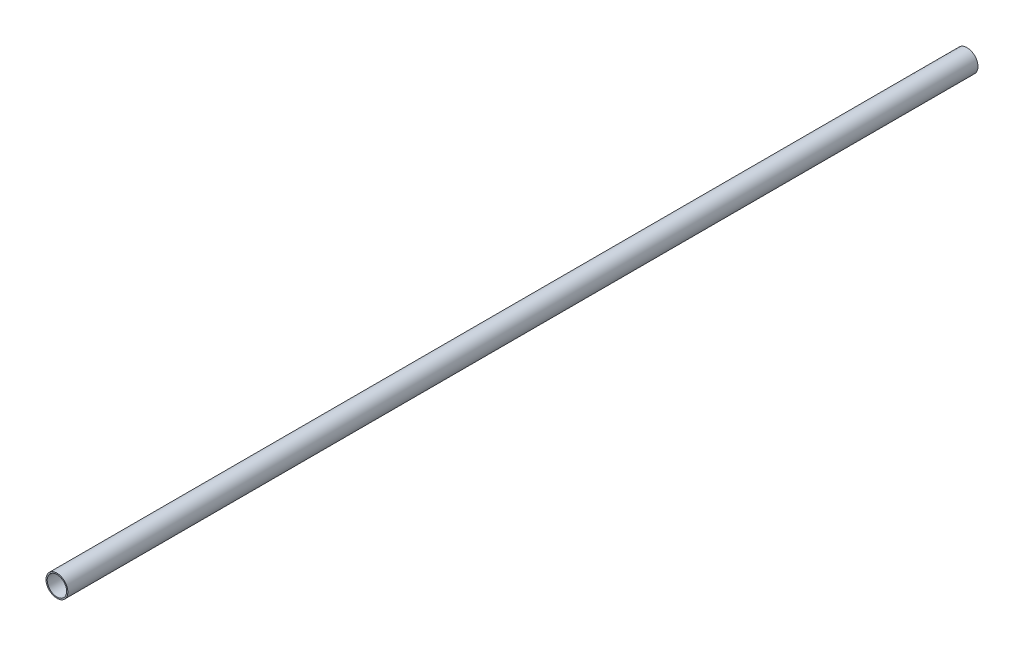
from build123d import *

# Parameters (mm, degrees)
SKETCH1_R           = 7.9375
SKETCH1_R_2         = 7.0485
BOSS_EXTRUDE1_DEPTH = 330.2


with BuildPart() as part:
    # Sketch1 → Boss-Extrude1 (new, symmetric)
    with BuildSketch(Plane.XY):
        Circle(SKETCH1_R)
        Circle(SKETCH1_R_2, mode=Mode.SUBTRACT)
    extrude(amount=BOSS_EXTRUDE1_DEPTH, both=True)


solid = part.part
